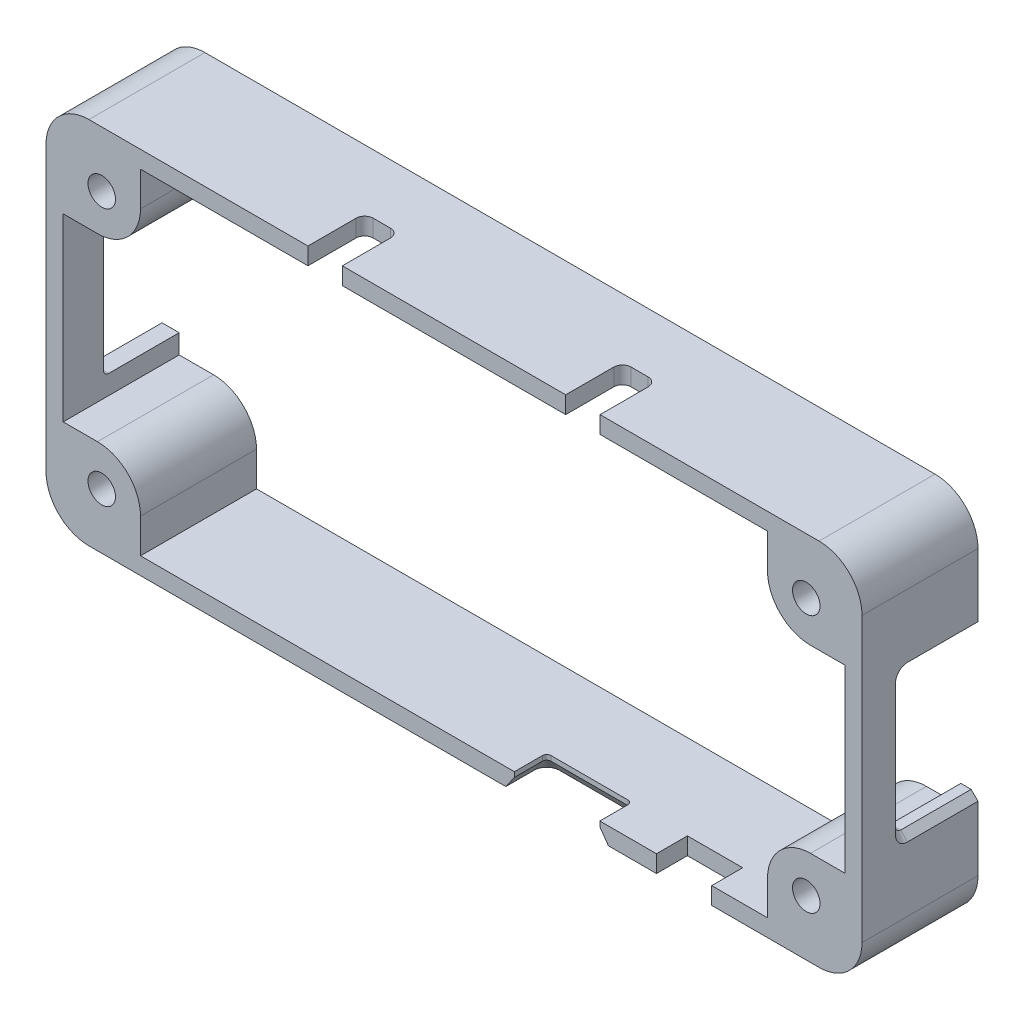
from build123d import *

# Parameters (mm, degrees)
SKETCH_1_W          = 94.97478029
SKETCH_1_H          = 42.97467615
SKETCH_1_W_2        = 90.97478029
SKETCH_1_H_2        = 38.97467615
EXTRUDE_1_DEPTH     = 13.5
SKETCH_2_W          = 9
SKETCH_2_H          = 9
EXTRUDE_2_DEPTH     = 13.5
SKETCH_3_R          = 1.6
CUT_EXTRUDE_1_DEPTH = 13.5
SKETCH_4_W          = 2
SKETCH_4_H          = 16.5
CUT_EXTRUDE_2_DEPTH = 8.8
FILLET_1_R          = 5
FILLET_2_R          = 0.6
SKETCH_5_W          = 4
SKETCH_5_H          = 6.600000242
CUT_EXTRUDE_3_DEPTH = 2
FILLET_3_R          = 1
SKETCH_6_W          = 6.428772381
SKETCH_6_H          = 3.6
SKETCH_6_W_2        = 9.94
SKETCH_6_H_2        = 3.75999995
CUT_EXTRUDE_4_DEPTH = 2
FILLET_4_R          = 0.5
CHAMFER_1_SIZE      = 1
CHAMFER_1_SIZE2     = 1.428148007
FILLET_5_R          = 5
CHAMFER_2_SIZE      = 0.8


with BuildPart() as part:
    # 草图1 → 凸台-拉伸1 (new body)
    with BuildSketch(Plane.XY.offset(1.6000508)):
        with Locations((45.00009017, -19.0000381)):
            Rectangle(SKETCH_1_W, SKETCH_1_H)
        with Locations((45.00009017, -19.0000381)):
            Rectangle(SKETCH_1_W_2, SKETCH_1_H_2, mode=Mode.SUBTRACT)
    extrude(amount=EXTRUDE_1_DEPTH)

    # 草图2 → 凸台-拉伸2 (add)
    with BuildSketch(Plane.XY.offset(1.6000508)):
        with Locations((4.012700025, -4.012700025)):
            Rectangle(SKETCH_2_W, SKETCH_2_H)
        with Locations((85.987480315, -4.012700025)):
            Rectangle(SKETCH_2_W, SKETCH_2_H)
        with Locations((4.012700025, -33.987376175)):
            Rectangle(SKETCH_2_W, SKETCH_2_H)
        with Locations((85.987480315, -33.987376175)):
            Rectangle(SKETCH_2_W, SKETCH_2_H)
    extrude(amount=EXTRUDE_2_DEPTH)

    # 草图3 → 切除-拉伸1 (cut)
    with BuildSketch(Plane.XY.offset(1.6000508)):
        with Locations((4.00000762, -4.00000762)):
            Circle(SKETCH_3_R)
        with Locations((86.00017272, -4.00000762)):
            Circle(SKETCH_3_R)
        with Locations((86.00017272, -34.00006858)):
            Circle(SKETCH_3_R)
        with Locations((4.00000762, -34.00006858)):
            Circle(SKETCH_3_R)
    extrude(amount=CUT_EXTRUDE_1_DEPTH, mode=Mode.SUBTRACT)

    # 草图4 → 切除-拉伸2 (cut)
    with BuildSketch(Plane.XY.offset(1.6000508)):
        with Locations((-1.487299975, -18.9999873)):
            Rectangle(SKETCH_4_W, SKETCH_4_H)
        with Locations((91.487480315, -18.939077978)):
            Rectangle(SKETCH_4_W, SKETCH_4_H)
    extrude(amount=CUT_EXTRUDE_2_DEPTH, mode=Mode.SUBTRACT)

    # 圆角1
    fillet_1_edges = [part.edges().sort_by_distance(p)[0] for p in [
        (81.487480315, -8.512700025, 8.3500508),
        (8.512700025, -29.487376175, 8.3500508),
        (81.487480315, -29.487376175, 8.3500508),
        (8.512700025, -8.512700025, 8.3500508),
    ]]
    fillet(fillet_1_edges, radius=FILLET_1_R)

    # 圆角2
    fillet_2_edges = [part.edges().sort_by_distance(p)[0] for p in [
        (-1.487299975, -27.2499873, 10.4000508),
        (-1.487299975, -10.7499873, 10.4000508),
        (91.487480315, -27.189077978, 10.4000508),
        (91.487480315, -10.689077978, 10.4000508),
    ]]
    fillet(fillet_2_edges, radius=FILLET_2_R)

    # 草图5 → 切除-拉伸3 (cut)
    with BuildSketch(Plane(origin=(0, 2.487299975, 0), x_dir=(1, 0, 0), z_dir=(0, 1, 0))):
        with Locations((30.00006096, -11.800050679)):
            Rectangle(SKETCH_5_W, SKETCH_5_H)
        with Locations((60.00011938, -11.800050679)):
            Rectangle(SKETCH_5_W, SKETCH_5_H)
    extrude(amount=-CUT_EXTRUDE_3_DEPTH, mode=Mode.SUBTRACT)

    # 圆角3
    fillet_3_edges = [part.edges().sort_by_distance(p)[0] for p in [
        (28.00006096, 1.487299975, 8.500050558),
        (32.00006096, 1.487299975, 8.500050558),
        (58.00011938, 1.487299975, 8.500050558),
        (62.00011938, 1.487299975, 8.500050558),
    ]]
    fillet(fillet_3_edges, radius=FILLET_3_R)

    # 草图6 → 切除-拉伸4 (cut)
    with BuildSketch(Plane.XZ.offset(40.487376175)):
        with Locations((71.78078399, 13.3000508)):
            Rectangle(SKETCH_6_W, SKETCH_6_H)
        with Locations((57.0001143, 13.220050825)):
            Rectangle(SKETCH_6_W_2, SKETCH_6_H_2)
    extrude(amount=-CUT_EXTRUDE_4_DEPTH, mode=Mode.SUBTRACT)

    # 圆角4
    fillet_4_edges = [part.edges().sort_by_distance(p)[0] for p in [
        (52.0301143, -39.487376175, 11.34005085),
        (61.9701143, -39.487376175, 11.34005085),
    ]]
    fillet(fillet_4_edges, radius=FILLET_4_R)

    # 倒角1
    chamfer_1_edges = [part.edges().sort_by_distance(p)[0] for p in [
        (52.0301143, -40.487376175, 13.470050825),
        (57.0001143, -40.487376175, 11.34005085),
        (61.9701143, -40.487376175, 13.470050825),
        (52.17656091, -40.487376175, 11.48649746),
        (61.823667691, -40.487376175, 11.48649746),
    ]]
    chamfer_1_side = [part.faces().sort_by_distance(p)[0] for p in [
        (44.12674601, -40.487376175, 8.107577696),
    ]]
    chamfer(chamfer_1_edges, length=CHAMFER_1_SIZE, length2=CHAMFER_1_SIZE2, reference=chamfer_1_side[0])

    # 圆角5
    fillet_5_edges = [part.edges().sort_by_distance(p)[0] for p in [
        (-2.487299975, 2.487299975, 8.3500508),
        (92.487480315, 2.487299975, 8.3500508),
        (92.487480315, -40.487376175, 8.3500508),
        (-2.487299975, -40.487376175, 8.3500508),
    ]]
    fillet(fillet_5_edges, radius=FILLET_5_R)

    # 倒角2
    chamfer_2_edges = [part.edges().sort_by_distance(p)[0] for p in [
        (92.487480315, -27.189077978, 5.7000508),
        (92.487480315, -18.939077978, 10.4000508),
        (92.487480315, -10.689077978, 5.7000508),
        (92.487480315, -27.013342047, 10.224314869),
        (92.487480315, -10.864813909, 10.224314869),
    ]]
    chamfer(chamfer_2_edges, length=CHAMFER_2_SIZE)


solid = part.part
